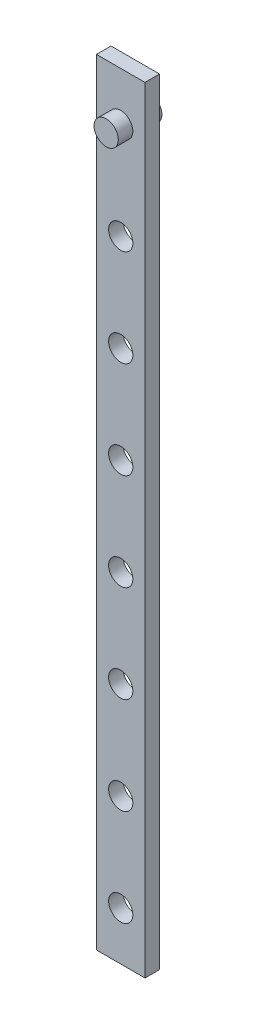
from build123d import *

# Parameters (mm, degrees)
SKETCH_1_W           = 10
SKETCH_1_H           = 160
SKETCH_1_R           = 2.5
EXTRUDE_1_DEPTH      = 3
EXTRUDE_2_DEPTH      = 3
EXTRUDE_2_DEPTH_BACK = 6
SKETCH_2_R           = 2.5


with BuildPart() as part:
    # 草圖1 → 填料-伸長1 (new body)
    with BuildSketch(Plane.XY):
        Rectangle(SKETCH_1_W, SKETCH_1_H)
        with Locations((0, -70)):
            Circle(SKETCH_1_R, mode=Mode.SUBTRACT)
        with Locations((0, -50)):
            Circle(SKETCH_1_R, mode=Mode.SUBTRACT)
        with Locations((0, -30)):
            Circle(SKETCH_1_R, mode=Mode.SUBTRACT)
        with Locations((0, -10)):
            Circle(SKETCH_1_R, mode=Mode.SUBTRACT)
        with Locations((0, 10)):
            Circle(SKETCH_1_R, mode=Mode.SUBTRACT)
        with Locations((0, 30)):
            Circle(SKETCH_1_R, mode=Mode.SUBTRACT)
        with Locations((0, 50)):
            Circle(SKETCH_1_R, mode=Mode.SUBTRACT)
    extrude(amount=EXTRUDE_1_DEPTH)

    # 草圖2 → 填料-伸長2 (add, two sides: drawn at the far end of the back side and taken through both)
    with BuildSketch(Plane.XY.offset(3).offset(-EXTRUDE_2_DEPTH_BACK)):
        with Locations((0, 70)):
            Circle(SKETCH_2_R)
    extrude(amount=EXTRUDE_2_DEPTH + EXTRUDE_2_DEPTH_BACK)


solid = part.part
